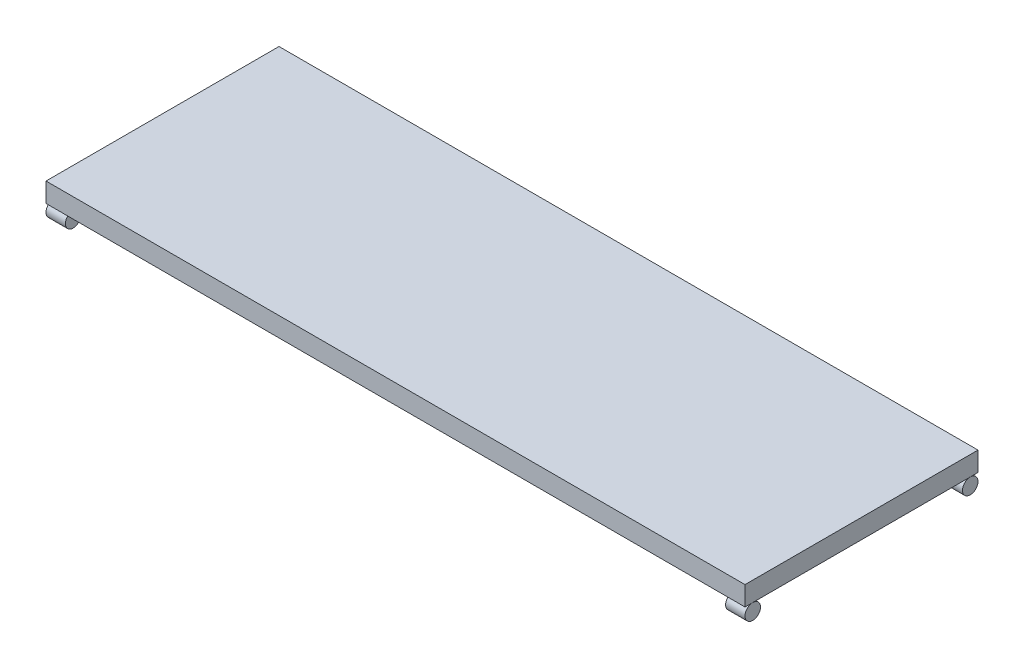
from build123d import *

# Parameters (mm, degrees)
SKETCH_5_W        = 1800
SKETCH_5_H        = 600
EXTRUDE_4_DEPTH   = 50
SKETCH_6_R        = 20
EXTRUDE_5_DEPTH   = 50
EXTRUDE_5_2_DEPTH = 50
SKETCH_7_R        = 20
EXTRUDE_6_DEPTH   = 50
EXTRUDE_6_2_DEPTH = 50


with BuildPart() as part:
    # 草图5 → 凸台-拉伸4 (new body)
    with BuildSketch(Plane(origin=(0, 0, 0), x_dir=(1, 0, 0), z_dir=(0, 1, 0))):
        with Locations((900, 300)):
            Rectangle(SKETCH_5_W, SKETCH_5_H)
    extrude(amount=EXTRUDE_4_DEPTH)


with BuildPart() as body_2:
    # 草图6 → 凸台-拉伸5 (new body)
    with BuildSketch(Plane(origin=(0, 0, 0), x_dir=(0, 0, -1), z_dir=(1, 0, 0))):
        with Locations((20, -20)):
            Circle(SKETCH_6_R)
    extrude(amount=EXTRUDE_5_DEPTH)


with BuildPart() as body_3:
    # 草图6 → Extrude 5 2 (new body)
    with BuildSketch(Plane(origin=(0, 0, 0), x_dir=(0, 0, -1), z_dir=(1, 0, 0))):
        with Locations((580, -20)):
            Circle(SKETCH_6_R)
    extrude(amount=EXTRUDE_5_2_DEPTH)


with BuildPart() as body_4:
    # 草图7 → 凸台-拉伸6 (new body)
    with BuildSketch(Plane(origin=(1800, 0, 0), x_dir=(0, 0, -1), z_dir=(1, 0, 0))):
        with Locations((20, -20)):
            Circle(SKETCH_7_R)
    extrude(amount=-EXTRUDE_6_DEPTH)


with BuildPart() as body_5:
    # 草图7 → Extrude 6 2 (new body)
    with BuildSketch(Plane(origin=(1800, 0, 0), x_dir=(0, 0, -1), z_dir=(1, 0, 0))):
        with Locations((580, -20)):
            Circle(SKETCH_7_R)
    extrude(amount=-EXTRUDE_6_2_DEPTH)


solid = Compound([part.part, body_2.part, body_3.part, body_4.part, body_5.part])
